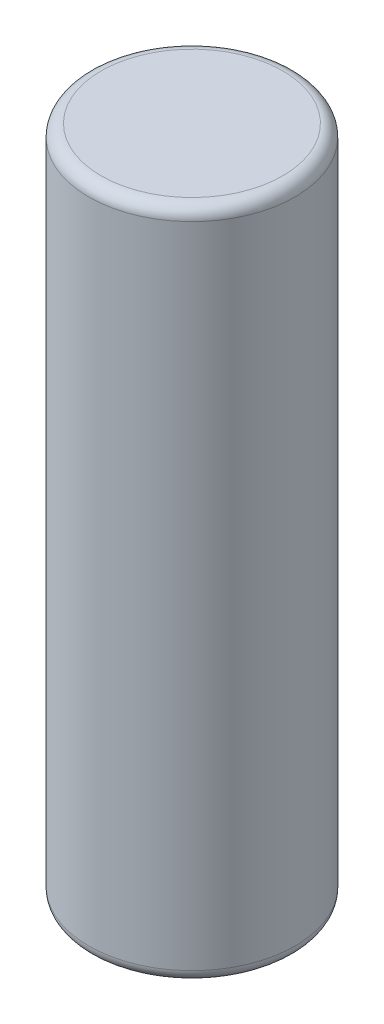
from build123d import *

# Parameters (mm, degrees)
SKETCH1_R           = 10.700004
BOSS_EXTRUDE1_DEPTH = 69.85
FILLET1_R           = 1.27


with BuildPart() as part:
    # Sketch1 → Boss-Extrude1 (new body)
    with BuildSketch(Plane(origin=(0, 0, 0), x_dir=(1, 0, 0), z_dir=(0, 1, 0))):
        with Locations(Location((0, 0, 0), (0, 0, 270))):
            Circle(SKETCH1_R)
    extrude(amount=BOSS_EXTRUDE1_DEPTH)

    # Fillet1
    fillet1_edges = [part.edges().sort_by_distance(p)[0] for p in [
        (0, 0, -10.700004),
        (0, 69.85, -10.700004),
    ]]
    fillet(fillet1_edges, radius=FILLET1_R)


solid = part.part
